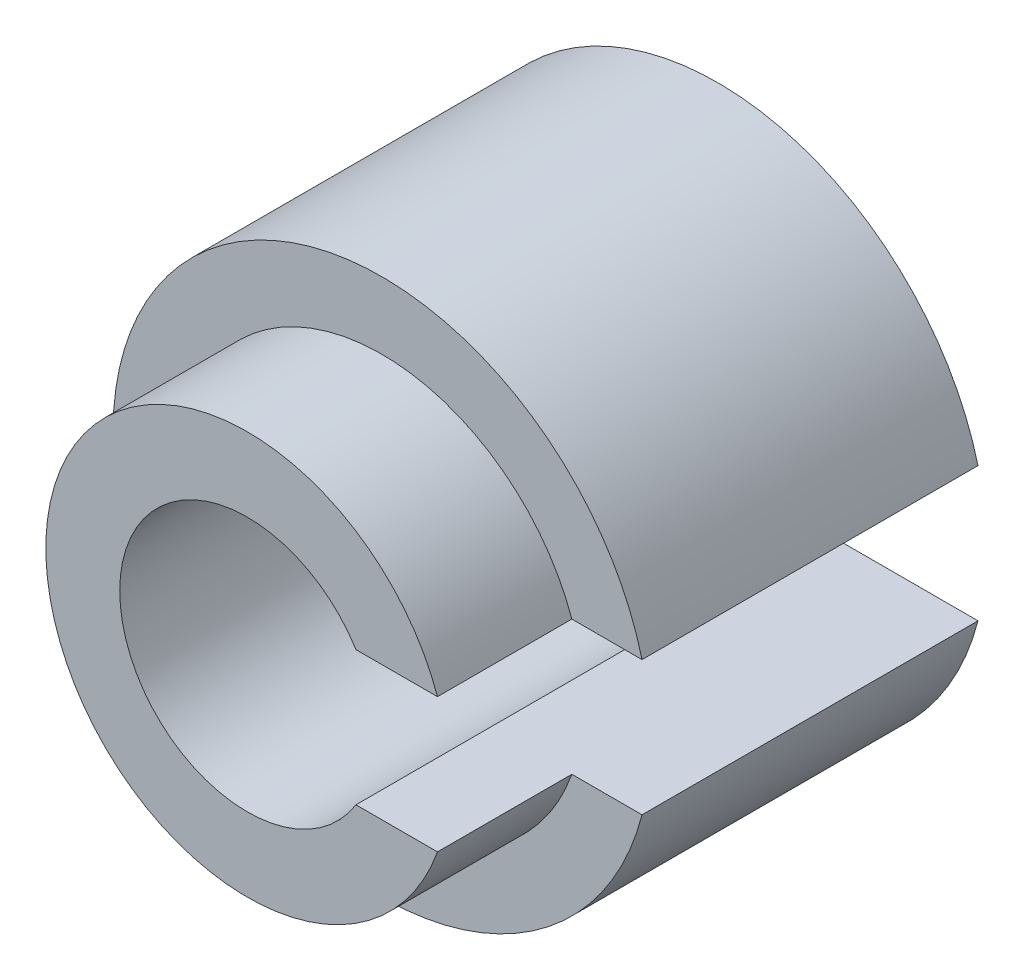
from build123d import *

# Parameters (mm, degrees)
SKETCH_1_R          = 4
EXTRUDE_1_DEPTH     = 5
SKETCH_2_R          = 3
EXTRUDE_2_DEPTH     = 2
SKETCH_3_R          = 1.9
CUT_EXTRUDE_1_DEPTH = 10
CUT_EXTRUDE_2_DEPTH = 1


with BuildPart() as part:
    # 草图1 → 凸台-拉伸1 (new body)
    with BuildSketch(Plane.XY):
        Circle(SKETCH_1_R)
    extrude(amount=EXTRUDE_1_DEPTH)

    # 草图2 → 凸台-拉伸2 (add)
    with BuildSketch(Plane.XY.offset(5)):
        Circle(SKETCH_2_R)
    extrude(amount=EXTRUDE_2_DEPTH)

    # 草图3 → 切除-拉伸1 (cut, through all)
    with BuildSketch(Plane.XY.offset(7)):
        Circle(SKETCH_3_R)
    extrude(amount=-CUT_EXTRUDE_1_DEPTH, mode=Mode.SUBTRACT)

    # 草图4 → 切除-拉伸2 (cut, symmetric)
    with BuildSketch(Plane(origin=(0, 0, 0), x_dir=(1, 0, 0), z_dir=(0, 1, 0))):
        Polygon((0, 0), (4, 0), (4, -5), (3, -5), (3, -7), (0, -7), align=None)
    extrude(amount=CUT_EXTRUDE_2_DEPTH, both=True, mode=Mode.SUBTRACT)


solid = part.part
